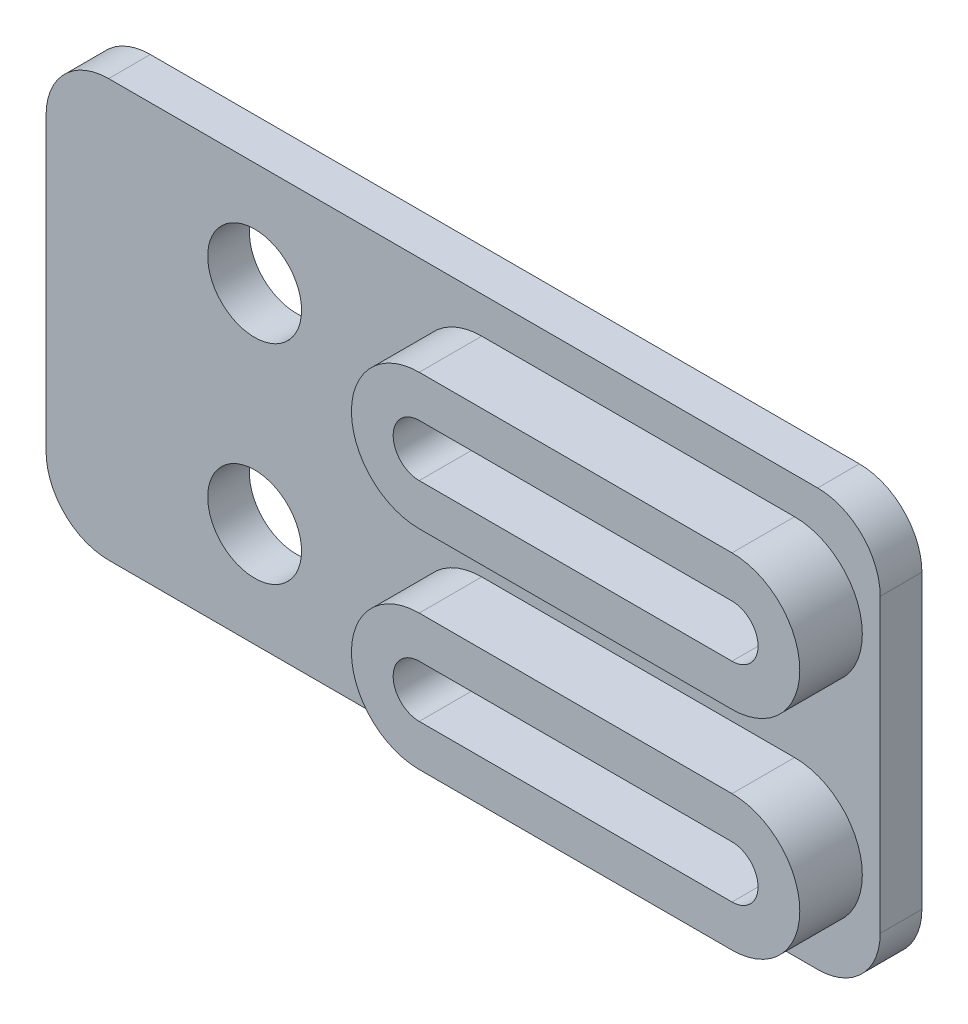
from build123d import *

# Parameters (mm, degrees)
SZKIC1_W                    = 40
SZKIC1_H                    = 20
SZKIC1_R                    = 2.25
DODANIE_WYCI_GNI_CIE1_DEPTH = 2
DODANIE_WYCI_GNI_CIE2_DEPTH = 5
ZAOKR_GLENIE1_R             = 3


with BuildPart() as part:
    # Szkic1 → Dodanie-wyciągnięcie1 (new body)
    with BuildSketch(Plane.XY):
        with Locations((0.494567618, 0.286392586)):
            Rectangle(SZKIC1_W, SZKIC1_H)
        with Locations((-9.505432382, -4.713607414)):
            Circle(SZKIC1_R, mode=Mode.SUBTRACT)
        with BuildLine():
            ThreePointArc((1.387577827, -7.963607414), (-1.862422173, -4.713607414), (1.387577827, -1.463607414))
            Line((1.387577827, -1.463607414), (16.387577827, -1.463607414))
            ThreePointArc((16.387577827, -1.463607414), (19.637577827, -4.713607414), (16.387577827, -7.963607414))
            Line((16.387577827, -7.963607414), (1.387577827, -7.963607414))
        make_face(mode=Mode.SUBTRACT)
        with Locations((-9.505432382, 5.286392586)):
            Circle(SZKIC1_R, mode=Mode.SUBTRACT)
        with BuildLine():
            ThreePointArc((1.387577827, 2.036392586), (-1.862422173, 5.286392586), (1.387577827, 8.536392586))
            Line((1.387577827, 8.536392586), (16.387577827, 8.536392586))
            ThreePointArc((16.387577827, 8.536392586), (19.637577827, 5.286392586), (16.387577827, 2.036392586))
            Line((16.387577827, 2.036392586), (1.387577827, 2.036392586))
        make_face(mode=Mode.SUBTRACT)
    extrude(amount=DODANIE_WYCI_GNI_CIE1_DEPTH)

    # Szkic1<3> → Dodanie-wyciągnięcie2 (add)
    # profile 1 of 2: a face of its own
    with BuildSketch(Plane.XY):
        with BuildLine():
            Line((16.387577827, -1.463607414), (1.387577827, -1.463607414))
            ThreePointArc((1.387577827, -1.463607414), (-1.862422173, -4.713607414), (1.387577827, -7.963607414))
            Line((1.387577827, -7.963607414), (16.387577827, -7.963607414))
            ThreePointArc((16.387577827, -7.963607414), (19.637577827, -4.713607414), (16.387577827, -1.463607414))
        make_face()
        with BuildLine():
            ThreePointArc((1.387577827, -5.963607414), (0.137577827, -4.713607414), (1.387577827, -3.463607414))
            Line((1.387577827, -3.463607414), (16.387577827, -3.463607414))
            ThreePointArc((16.387577827, -3.463607414), (17.637577827, -4.713607414), (16.387577827, -5.963607414))
            Line((16.387577827, -5.963607414), (1.387577827, -5.963607414))
        make_face(mode=Mode.SUBTRACT)
    # profile 2 of 2: a face of its own
    with BuildSketch(Plane.XY):
        with BuildLine():
            Line((16.387577827, 8.536392586), (1.387577827, 8.536392586))
            ThreePointArc((1.387577827, 8.536392586), (-1.862422173, 5.286392586), (1.387577827, 2.036392586))
            Line((1.387577827, 2.036392586), (16.387577827, 2.036392586))
            ThreePointArc((16.387577827, 2.036392586), (19.637577827, 5.286392586), (16.387577827, 8.536392586))
        make_face()
        with BuildLine():
            ThreePointArc((1.387577827, 4.036392586), (0.137577827, 5.286392586), (1.387577827, 6.536392586))
            Line((1.387577827, 6.536392586), (16.387577827, 6.536392586))
            ThreePointArc((16.387577827, 6.536392586), (17.637577827, 5.286392586), (16.387577827, 4.036392586))
            Line((16.387577827, 4.036392586), (1.387577827, 4.036392586))
        make_face(mode=Mode.SUBTRACT)
    extrude(amount=DODANIE_WYCI_GNI_CIE2_DEPTH)

    # Zaokrąglenie1
    zaokr_glenie1_edges = [part.edges().sort_by_distance(p)[0] for p in [
        (-19.505432382, -9.713607414, 1),
        (20.494567618, -9.713607414, 1),
        (20.494567618, 10.286392586, 1),
        (-19.505432382, 10.286392586, 1),
    ]]
    fillet(zaokr_glenie1_edges, radius=ZAOKR_GLENIE1_R)


solid = part.part
